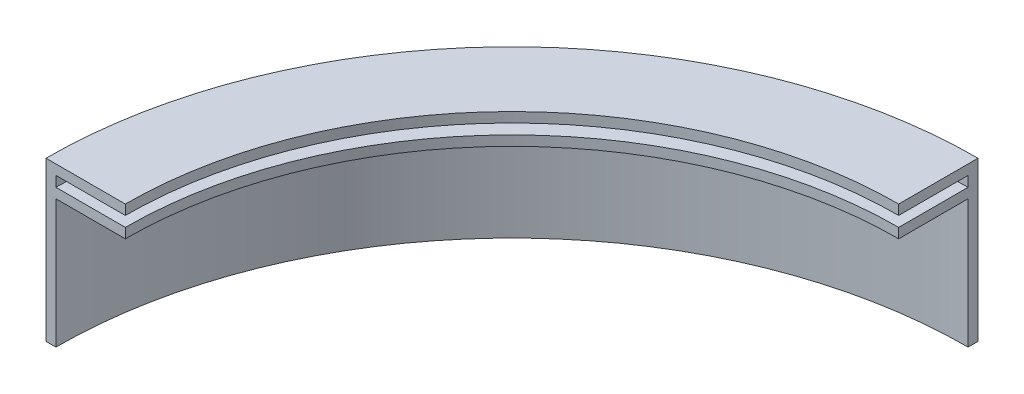
from build123d import *

# Parameters (mm, degrees)
REVOLVE1_ANGLE = 90


with BuildPart() as part:
    # Sketch1 → Revolve1 (revolve)
    with BuildSketch(Plane.XY):
        Polygon((0, 0), (0, 50.8), (25.4, 50.8), (25.4, 47.625), (3.175, 47.625), (3.175, 44.323), (25.4, 44.323), (25.4, 41.148), (3.175, 41.148), (3.175, 0), align=None)
    revolve(axis=Axis((149.225, 38.1, 0), (0, -1, 0)), revolution_arc=REVOLVE1_ANGLE)


solid = part.part
